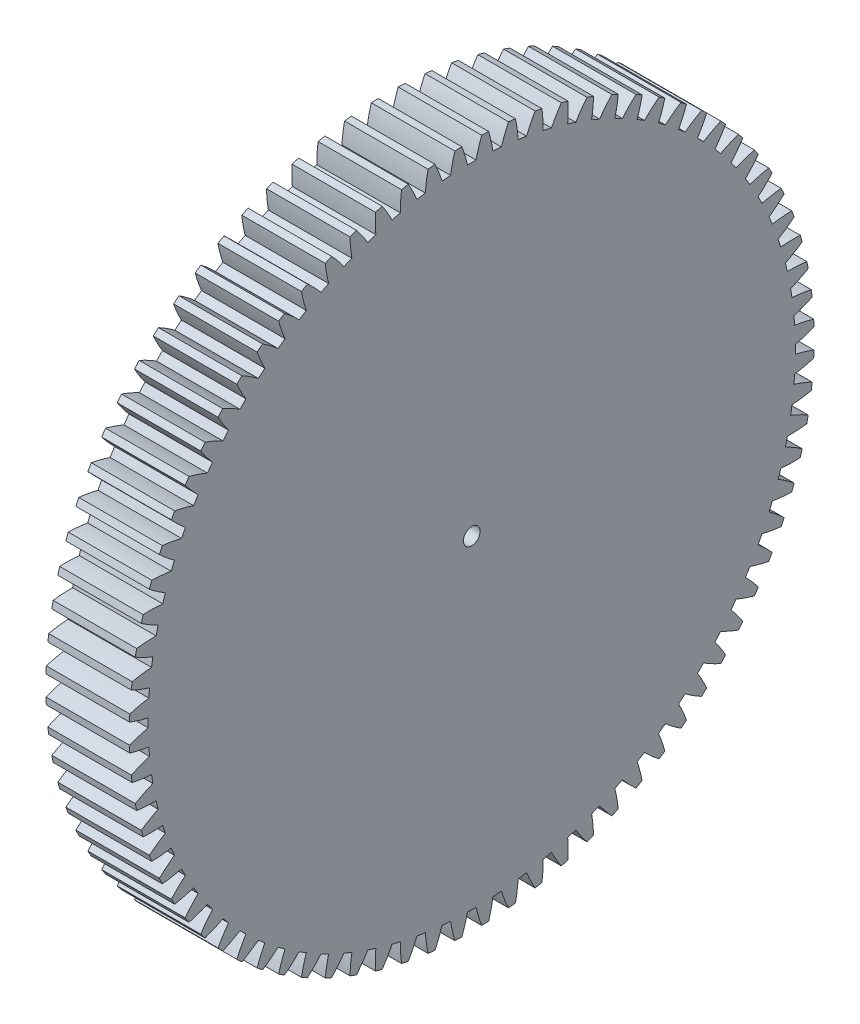
from build123d import *

# Parameters (mm, degrees)
BASPROSKE_W     = 15
BASPROSKE_H     = 61.5
TOOTHCUT_DEPTH  = 89.2581441
TEETHCUTS_COUNT = 80
BORSKE_R        = 1.5
BORE_DEPTH      = 50.0000508


with BuildPart() as part:
    # BasProSke → Base-Revolve (revolve)
    with BuildSketch(Plane(origin=(0, 0, 0), x_dir=(1, 0, 0), z_dir=(0, 1, 0)), mode=Mode.PRIVATE) as base_revolve_sk:
        with Locations((7.5, 30.75)):
            Rectangle(BASPROSKE_W, BASPROSKE_H)
    revolve(base_revolve_sk.sketch.rotate(Axis((-10, 0, 0), (1, 0, 0)), 180), axis=Axis((-10, 0, 0), (1, 0, 0)))

    # TooCutSke → ToothCut (cut, through all)
    with BuildSketch(Plane(origin=(0, 0, 0), x_dir=(0, 0, -1), z_dir=(1, 0, 0))):
        with BuildLine():
            ThreePointArc((0.768008066, 58.11892583), (0, 58.124), (-0.768008066, 58.11892583))
            ThreePointArc((-0.768008066, 58.11892583), (-1.221763916, 59.828017283), (-1.800127149, 61.499060053))
            ThreePointArc((-1.800127149, 61.499060053), (0, 61.5254), (1.800127149, 61.499060053))
            ThreePointArc((1.800127149, 61.499060053), (1.221763916, 59.828017283), (0.768008066, 58.11892583))
        make_face()
    toothcut = extrude(amount=TOOTHCUT_DEPTH, mode=Mode.SUBTRACT)

    # TeethCuts: ToothCut ×80 about axis
    teethcuts_axis = Axis((0, 0, 0), (1, 0, 0))
    for i in range(1, TEETHCUTS_COUNT):
        add(toothcut.rotate(teethcuts_axis, i * 360 / TEETHCUTS_COUNT), mode=Mode.SUBTRACT)

    # BorSke → Bore (cut, symmetric)
    with BuildSketch(Plane(origin=(0, 0, 0), x_dir=(0, 0, -1), z_dir=(1, 0, 0))):
        with Locations(Location((0, 0, 0), (0, 0, 180))):
            Circle(BORSKE_R)
    extrude(amount=BORE_DEPTH, both=True, mode=Mode.SUBTRACT)


solid = part.part
